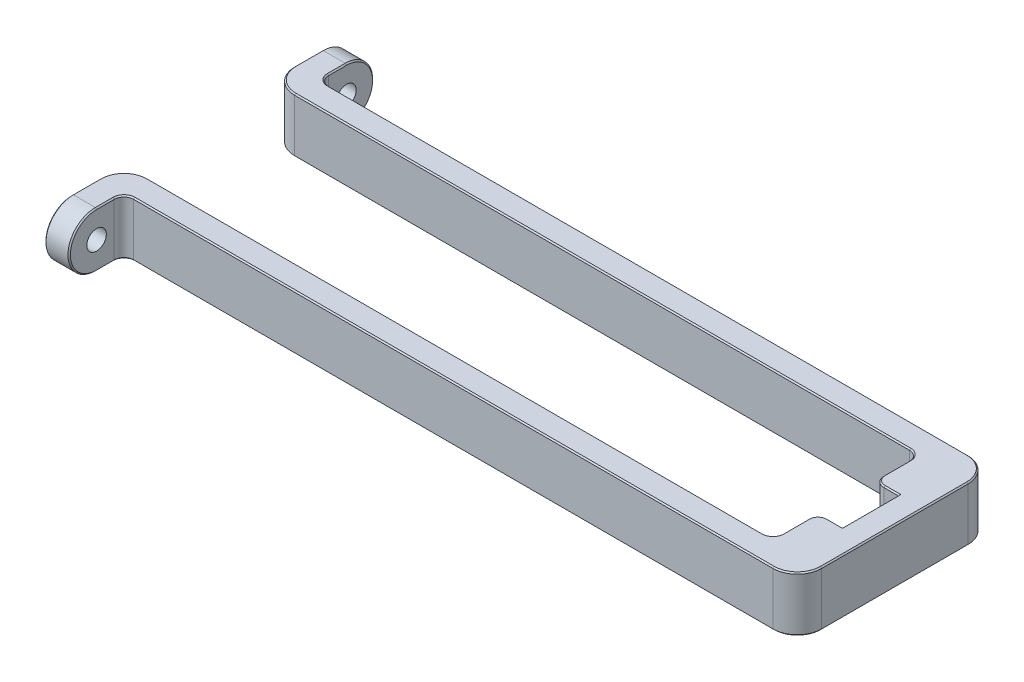
from build123d import *

# Parameters (mm, degrees)
EXTRUDE_1_DEPTH = 9
SKETCH_2_R      = 1.6
EXTRUDE_2_DEPTH = 4
FILLET_1_R      = 4
FILLET_2_R      = 1.6
CHAMFER_1_SIZE  = 0.2


with BuildPart() as part:
    # 草图1 → 凸台-拉伸1 (new body)
    with BuildSketch(Plane(origin=(0, 0, 0), x_dir=(1, 0, 0), z_dir=(0, 1, 0))):
        Polygon((106.5, 0), (0, 0), (0, -4), (114.5, -4), (114.5, 28), (0, 28), (0, 24), (106.5, 24), (106.5, 16.6), (110.5, 16.6), (110.5, 7.4), (106.5, 7.4), align=None)
    extrude(amount=EXTRUDE_1_DEPTH)

    # 草图2 → 凸台-拉伸2 (add)
    # profile 1 of 2: a face of its own
    with BuildSketch(Plane.ZY):
        with BuildLine():
            Line((8.5, 9), (4, 9))
            Line((4, 9), (4, 0))
            Line((4, 0), (8.5, 0))
            ThreePointArc((8.5, 0), (13, 4.5), (8.5, 9))
        make_face()
        with Locations((8.5, 4.5)):
            Circle(SKETCH_2_R, mode=Mode.SUBTRACT)
    # profile 2 of 2: a face of its own
    with BuildSketch(Plane.ZY):
        with BuildLine():
            Line((-28, 0), (-28, 9))
            Line((-28, 9), (-32.5, 9))
            ThreePointArc((-32.5, 9), (-37, 4.5), (-32.5, 0))
            Line((-32.5, 0), (-28, 0))
        make_face()
        with Locations((-32.5, 4.5)):
            Circle(SKETCH_2_R, mode=Mode.SUBTRACT)
    extrude(amount=-EXTRUDE_2_DEPTH)

    # 圆角1
    fillet_1_edges = [part.edges().sort_by_distance(p)[0] for p in [
        (0, 4.5, -24),
        (114.5, 4.5, -28),
        (114.5, 4.5, 4),
        (0, 4.5, 0),
    ]]
    fillet(fillet_1_edges, radius=FILLET_1_R)

    # 圆角2
    fillet_2_edges = [part.edges().sort_by_distance(p)[0] for p in [
        (106.5, 4.5, -16.6),
        (106.5, 4.5, -24),
        (106.5, 4.5, 0),
        (106.5, 4.5, -7.4),
        (4, 4.5, -28),
        (4, 4.5, 4),
    ]]
    fillet(fillet_2_edges, radius=FILLET_2_R)

    # 倒角1
    chamfer_1_edges = [part.edges().sort_by_distance(p)[0] for p in [
        (106.5, 0, -3.7),
        (106.5, 9, -3.7),
        (58.05, 0, -28),
        (58.05, 0, 4),
        (54.45, 0, 0),
        (106.5, 0, -20.3),
        (106.96862915, 0, -17.06862915),
        (106.96862915, 0, -6.93137085),
        (58.05, 9, -28),
        (4, 9, -31.05),
        (106.5, 9, -20.3),
        (54.45, 9, 0),
        (4, 9, 7.05),
        (58.05, 9, 4),
        (106.96862915, 9, -17.06862915),
        (106.96862915, 9, -6.93137085),
        (109.3, 9, -7.4),
        (106.03137085, 0, -0.46862915),
        (106.03137085, 9, -0.46862915),
        (4.46862915, 9, 4.46862915),
        (4.46862915, 0, 4.46862915),
        (4.46862915, 0, -28.46862915),
        (4.46862915, 9, -28.46862915),
        (106.03137085, 0, -23.53137085),
        (106.03137085, 9, -23.53137085),
        (109.3, 0, -7.4),
        (110.5, 0, -12),
        (109.3, 0, -16.6),
        (109.3, 9, -16.6),
        (0, 4.5, -37),
        (4, 0, -31.05),
        (4, 4.5, -37),
        (4, 4.5, 13),
        (4, 0, 7.05),
        (0, 4.5, 13),
        (54.45, 0, -24),
        (0, 0, -30.25),
        (114.5, 0, -12),
        (0, 0, 6.25),
        (1.171572875, 0, -25.171572875),
        (1.171572875, 0, 1.171572875),
        (113.328427125, 0, 2.828427125),
        (113.328427125, 0, -26.828427125),
        (114.5, 9, -12),
        (110.5, 9, -12),
        (0, 9, 6.25),
        (0, 9, -30.25),
        (54.45, 9, -24),
        (1.171572875, 9, -25.171572875),
        (1.171572875, 9, 1.171572875),
        (113.328427125, 9, 2.828427125),
        (113.328427125, 9, -26.828427125),
    ]]
    chamfer(chamfer_1_edges, length=CHAMFER_1_SIZE)


solid = part.part
